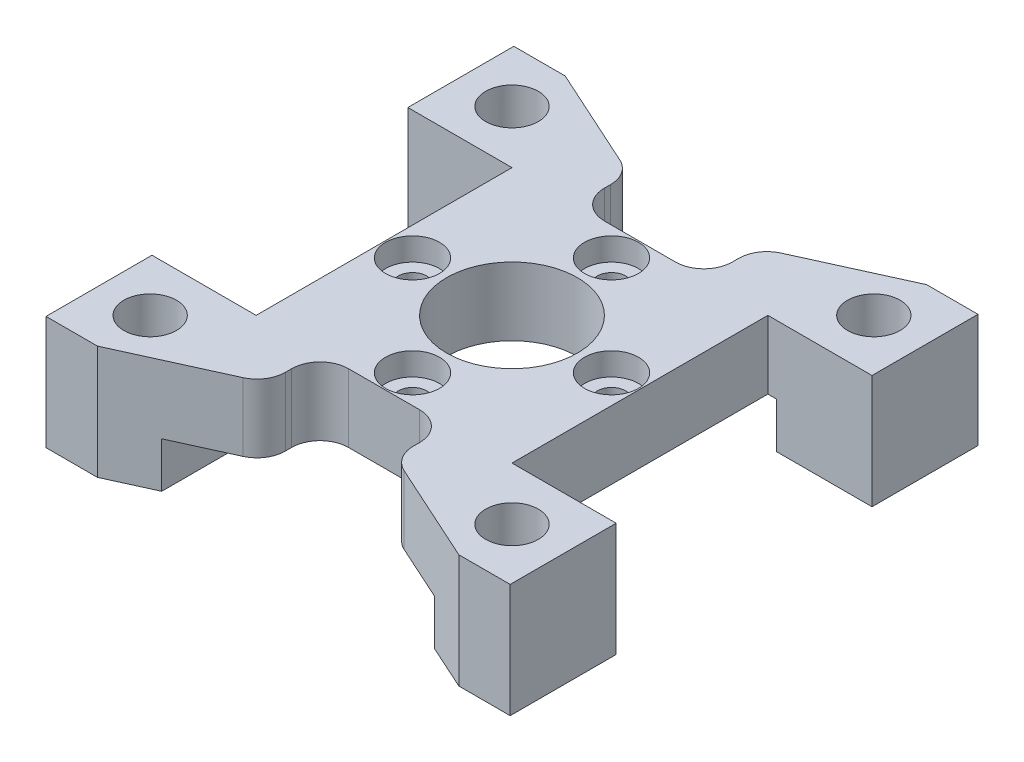
from build123d import *

# Parameters (mm, degrees)
BOSS_EXTRUDE1_DEPTH      = 12
BOSS_EXTRUDE2_DEPTH      = 12
BOSS_EXTRUDE2_DEPTH_BACK = 8
SKETCH2_R                = 11.5
SKETCH2_R_2              = 4.625
SKETCH2_R_3              = 2.5
CUT_EXTRUDE1_DEPTH       = 62.308564335
CUT_EXTRUDE2_DEPTH       = 60.183951041
CUT_EXTRUDE2_DEPTH_BACK  = 4.45
SKETCH3_R                = 7.625
FILLET3_R                = 5
SKETCH4_R                = 4.75
CUT_EXTRUDE3_DEPTH       = 4


with BuildPart() as part:
    # Sketch1 → Boss-Extrude1 (new body)
    with BuildSketch(Plane(origin=(0, 0, 0), x_dir=(1, 0, 0), z_dir=(0, 1, 0))):
        Polygon((-22.5, 22.5), (-22.5, -22.5), (-24, -22.5), (-24, -37.605531925), (-11.25, -31.819805153), (-11.25, -22.5), (11.25, -22.5), (11.25, -31.819805153), (24, -37.605531925), (24, -22.5), (22.5, -22.5), (22.5, 22.5), (24, 22.5), (24, 37.605531925), (11.25, 31.819805153), (11.25, 22.5), (-11.25, 22.5), (-11.25, 31.819805153), (-24, 37.605531925), (-24, 22.5), align=None)
    extrude(amount=BOSS_EXTRUDE1_DEPTH)

    # Sketch1<3> → Boss-Extrude2 (add, two sides: drawn at the far end of the back side and taken through both)
    with BuildSketch(Plane(origin=(0, 0, 0), x_dir=(1, 0, 0), z_dir=(0, 1, 0)).offset(-BOSS_EXTRUDE2_DEPTH_BACK)):
        Polygon((-24, -37.605531925), (-24, -22.5), (-40.819805153, -22.5), (-40.819805153, -41.139805153), (-31.788474194, -41.139805153), align=None)
        Polygon((-40.819805153, 22.5), (-24, 22.5), (-24, 37.605531925), (-31.788474194, 41.139805153), (-40.819805153, 41.139805153), align=None)
        Polygon((24, -22.5), (24, -37.605531925), (31.788474194, -41.139805153), (40.819805153, -41.139805153), (40.819805153, -22.5), align=None)
        Polygon((31.788474194, 41.139805153), (24, 37.605531925), (24, 22.5), (40.819805153, 22.5), (40.819805153, 41.139805153), align=None)
    extrude(amount=BOSS_EXTRUDE2_DEPTH + BOSS_EXTRUDE2_DEPTH_BACK)

    # Sketch2 → Cut-Extrude1 (cut, through all)
    with BuildSketch(Plane(origin=(0, 12, 0), x_dir=(1, 0, 0), z_dir=(0, 1, 0))):
        with Locations(Location((0, 0, 0), (0, 0, 270))):
            Circle(SKETCH2_R)
        with Locations(Location((-31.819805153, 31.819805153, 0), (0, 0, 270))):
            Circle(SKETCH2_R_2)
        with Locations(Location((31.819805153, 31.819805153, 0), (0, 0, 270))):
            Circle(SKETCH2_R_2)
        with Locations(Location((31.819805153, -31.819805153, 0), (0, 0, 270))):
            Circle(SKETCH2_R_2)
        with Locations(Location((-31.819805153, -31.819805153, 0), (0, 0, 270))):
            Circle(SKETCH2_R_2)
        with Locations(Location((0, 17.5, 0), (0, 0, 270))):
            Circle(SKETCH2_R_3)
        with Locations(Location((17.5, 0, 0), (0, 0, 270))):
            Circle(SKETCH2_R_3)
        with Locations(Location((0, -17.5, 0), (0, 0, 270))):
            Circle(SKETCH2_R_3)
        with Locations(Location((-17.5, 0, 0), (0, 0, 270))):
            Circle(SKETCH2_R_3)
    extrude(amount=-CUT_EXTRUDE1_DEPTH, mode=Mode.SUBTRACT)

    # Sketch3 → Cut-Extrude2 (cut, two sides: drawn at the far end of the back side and taken through both)
    with BuildSketch(Plane.XZ.offset(-CUT_EXTRUDE2_DEPTH_BACK)):
        with Locations(Location((31.819805153, -31.819805153, 0), (0, 0, 270))):
            Circle(SKETCH3_R)
        with Locations(Location((-31.819805153, -31.819805153, 0), (0, 0, 270))):
            Circle(SKETCH3_R)
        with Locations(Location((-31.819805153, 31.819805153, 0), (0, 0, 270))):
            Circle(SKETCH3_R)
        with Locations(Location((31.819805153, 31.819805153, 0), (0, 0, 270))):
            Circle(SKETCH3_R)
    extrude(amount=CUT_EXTRUDE2_DEPTH + CUT_EXTRUDE2_DEPTH_BACK, mode=Mode.SUBTRACT)

    # Fillet3
    fillet3_edges = [part.edges().sort_by_distance(p)[0] for p in [
        (11.25, 6, 31.819805153),
        (11.25, 6, 22.5),
        (-11.25, 6, 22.5),
        (-11.25, 6, 31.819805153),
        (-11.25, 6, -31.819805153),
        (-11.25, 6, -22.5),
        (11.25, 6, -22.5),
        (11.25, 6, -31.819805153),
    ]]
    fillet(fillet3_edges, radius=FILLET3_R)

    # Sketch4 → Cut-Extrude3 (cut)
    with BuildSketch(Plane(origin=(0, 12, 0), x_dir=(1, 0, 0), z_dir=(0, 1, 0))):
        with Locations(Location((0, 17.5, 0), (0, 0, 270))):
            Circle(SKETCH4_R)
        with Locations(Location((17.5, 0, 0), (0, 0, 270))):
            Circle(SKETCH4_R)
        with Locations(Location((0, -17.5, 0), (0, 0, 270))):
            Circle(SKETCH4_R)
        with Locations(Location((-17.5, 0, 0), (0, 0, 270))):
            Circle(SKETCH4_R)
    extrude(amount=-CUT_EXTRUDE3_DEPTH, mode=Mode.SUBTRACT)


solid = part.part
